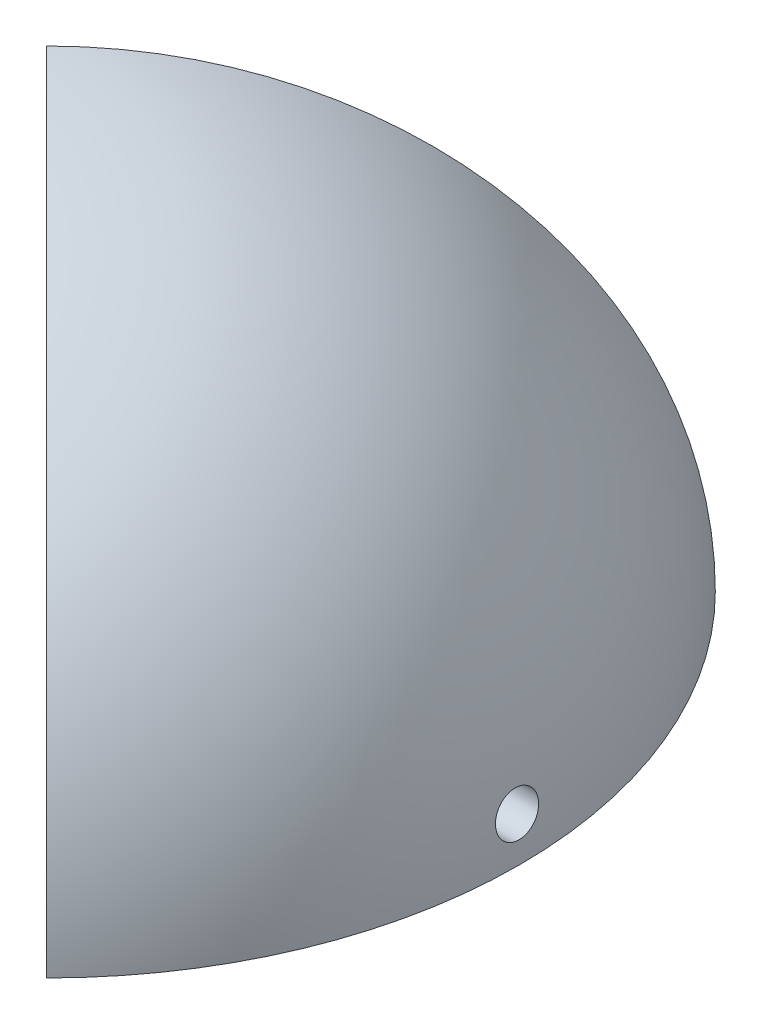
from build123d import *
from build123d.topology import SkipClean

# Parameters (mm, degrees)
REVOLVE1_ANGLE           = 45
REVOLVE1_OTHER_WAY_ANGLE = 45
BOSS_EXTRUDE1_DEPTH      = 10
BOSS_EXTRUDE1_DEPTH_BACK = 10
SKETCH2_W                = 10
SKETCH2_H                = 20
SKETCH3_R                = 5
CUT_EXTRUDE1_DEPTH       = 165.848415218


with BuildPart() as part:
    # Sketch1 → Revolve1 (revolve)
    with BuildSketch(Plane.XY):
        with BuildLine():
            Line((105, 0), (110, 0))
            ThreePointArc((110, 0), (77.781745931, 77.781745931), (0, 110))
            Line((0, 110), (0, 105))
            ThreePointArc((0, 105), (74.246212025, 74.246212025), (105, 0))
        make_face()
    revolve(axis=Axis((0, 110, 0), (0, -1, 0)), revolution_arc=REVOLVE1_ANGLE)

    # Sketch1 → Revolve1 other way (revolve)
    with SkipClean():  # the faces are left unmerged after this step: merging them gives an invalid solid
        with BuildSketch(Plane.XY):
            with BuildLine():
                Line((105, 0), (110, 0))
                ThreePointArc((110, 0), (77.781745931, 77.781745931), (0, 110))
                Line((0, 110), (0, 105))
                ThreePointArc((0, 105), (74.246212025, 74.246212025), (105, 0))
            make_face()
        revolve(axis=Axis((0, 110, 0), (0, 1, 0)), revolution_arc=REVOLVE1_OTHER_WAY_ANGLE)

    # Sketch2 → Boss-Extrude1 (add, two sides: drawn at the far end of the back side and taken through both)
    with SkipClean():  # the faces are left unmerged after this step: merging them gives an invalid solid
        with BuildSketch(Plane.XY.offset(-BOSS_EXTRUDE1_DEPTH_BACK)):
            with Locations((100, 10)):
                Rectangle(SKETCH2_W, SKETCH2_H)
        extrude(amount=BOSS_EXTRUDE1_DEPTH + BOSS_EXTRUDE1_DEPTH_BACK)

    # Sketch3 → Cut-Extrude1 (cut, through all)
    with SkipClean():  # the faces are left unmerged after this step: merging them gives an invalid solid
        with BuildSketch(Plane.ZY.offset(-95)):
            with Locations((0, 10)):
                Circle(SKETCH3_R)
        extrude(amount=-CUT_EXTRUDE1_DEPTH, mode=Mode.SUBTRACT)


solid = part.part
